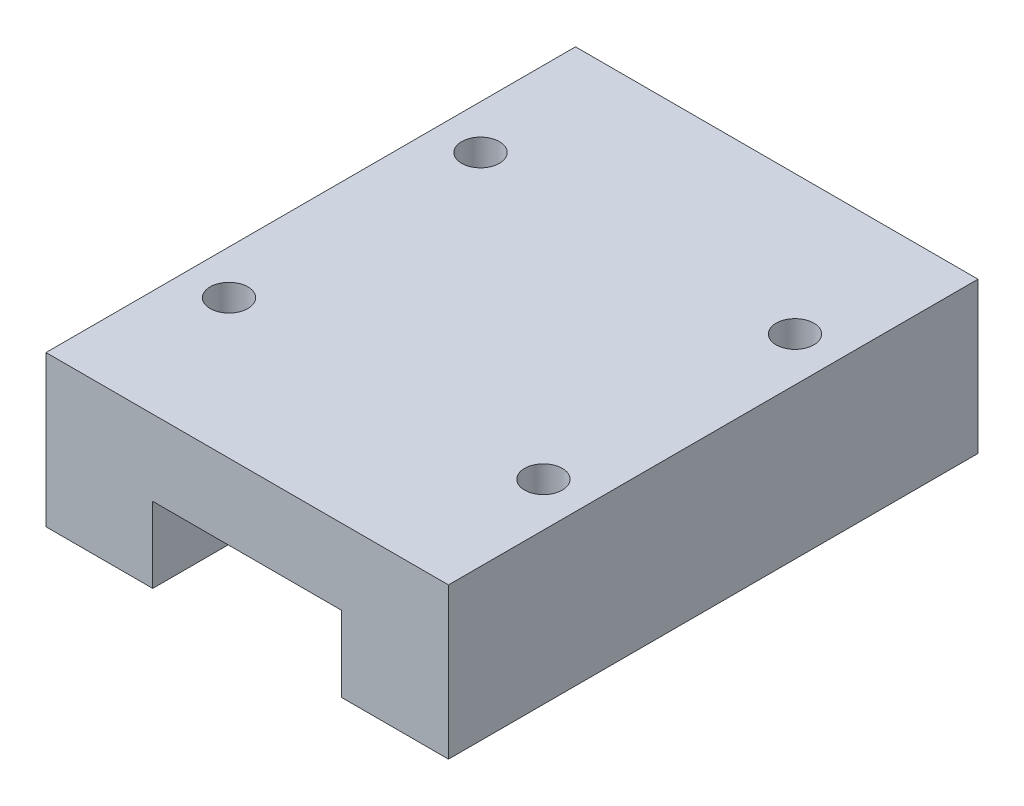
from build123d import *

# Parameters (mm, degrees)
SKETCH1_W           = 32
SKETCH1_H           = 12
BOSS_EXTRUDE1_DEPTH = 21.05
SKETCH2_W           = 15.014140453
SKETCH2_H           = 6
CUT_EXTRUDE1_DEPTH  = 46.435778853
SKETCH3_R           = 1.5
CUT_EXTRUDE2_DEPTH  = 6


with BuildPart() as part:
    # Sketch1 → Boss-Extrude1 (new, symmetric)
    with BuildSketch(Plane.XY):
        Rectangle(SKETCH1_W, SKETCH1_H)
    extrude(amount=BOSS_EXTRUDE1_DEPTH, both=True)

    # Sketch2 → Cut-Extrude1 (cut, through all)
    with BuildSketch(Plane.XY.offset(21.05)):
        with Locations((-0.007070226, -3)):
            Rectangle(SKETCH2_W, SKETCH2_H)
    extrude(amount=-CUT_EXTRUDE1_DEPTH, mode=Mode.SUBTRACT)

    # Sketch3 → Cut-Extrude2 (cut)
    with BuildSketch(Plane(origin=(0, 6, 0), x_dir=(1, 0, 0), z_dir=(0, 1, 0))):
        with Locations(Location((-12.5, 10, 0), (0, 0, 180))):
            Circle(SKETCH3_R)
        with Locations(Location((12.5, 10, 0), (0, 0, 180))):
            Circle(SKETCH3_R)
        with Locations(Location((12.5, -10, 0), (0, 0, 180))):
            Circle(SKETCH3_R)
        with Locations(Location((-12.5, -10, 0), (0, 0, 180))):
            Circle(SKETCH3_R)
    extrude(amount=-CUT_EXTRUDE2_DEPTH, mode=Mode.SUBTRACT)


solid = part.part
